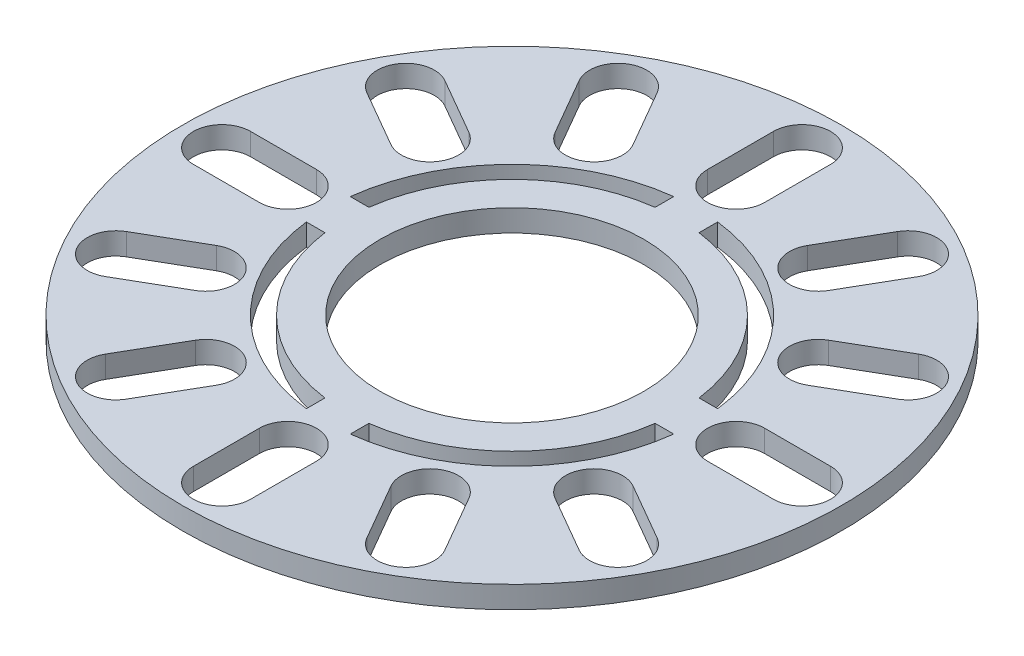
from build123d import *

# Parameters (mm, degrees)
SKETCH1_R           = 75
SKETCH1_R_2         = 30
BOSS_EXTRUDE1_DEPTH = 5
CUT_EXTRUDE1_DEPTH  = 107.183802908


with BuildPart() as part:
    # Sketch1 → Boss-Extrude1 (new body)
    with BuildSketch(Plane(origin=(0, 0, 0), x_dir=(1, 0, 0), z_dir=(0, 1, 0))):
        with Locations(Location((0, 0, 0), (0, 0, 270))):
            Circle(SKETCH1_R)
        with Locations(Location((0, 0, 0), (0, 0, 270))):
            Circle(SKETCH1_R_2, mode=Mode.SUBTRACT)
        with BuildLine():
            Line((-5, 41.802033443), (-5, 37.568737003))
            ThreePointArc((-5, 37.568737003), (-26.799347007, 26.799347007), (-37.568737003, 5))
            Line((-37.568737003, 5), (-41.802033443, 5))
            ThreePointArc((-41.802033443, 5), (-29.769195488, 29.769195488), (-5, 41.802033443))
        make_face(mode=Mode.SUBTRACT)
        with BuildLine():
            Line((5, 41.802033443), (5, 37.568737003))
            ThreePointArc((5, 37.568737003), (26.799347007, 26.799347007), (37.568737003, 5))
            Line((37.568737003, 5), (41.802033443, 5))
            ThreePointArc((41.802033443, 5), (29.769195488, 29.769195488), (5, 41.802033443))
        make_face(mode=Mode.SUBTRACT)
        with BuildLine():
            Line((41.802033443, -5), (37.568737003, -5))
            ThreePointArc((37.568737003, -5), (26.799347007, -26.799347007), (5, -37.568737003))
            Line((5, -37.568737003), (5, -41.802033443))
            ThreePointArc((5, -41.802033443), (29.769195488, -29.769195488), (41.802033443, -5))
        make_face(mode=Mode.SUBTRACT)
        with BuildLine():
            Line((-5, -41.802033443), (-5, -37.568737003))
            ThreePointArc((-5, -37.568737003), (-26.799347007, -26.799347007), (-37.568737003, -5))
            Line((-37.568737003, -5), (-41.802033443, -5))
            ThreePointArc((-41.802033443, -5), (-29.769195488, -29.769195488), (-5, -41.802033443))
        make_face(mode=Mode.SUBTRACT)
    extrude(amount=BOSS_EXTRUDE1_DEPTH)

    # Sketch4 → Cut-Extrude1 (cut, through all)
    with BuildSketch(Plane(origin=(0, 5, 0), x_dir=(1, 0, 0), z_dir=(0, 1, 0))):
        with BuildLine():
            Line((-6.5, 51), (-6.5, 66))
            ThreePointArc((-6.5, 66), (0, 72.5), (6.5, 66))
            Line((6.5, 66), (6.5, 51))
            ThreePointArc((6.5, 51), (0, 44.5), (-6.5, 51))
        make_face()
        with BuildLine():
            Line((31.129165125, 40.917295593), (38.629165125, 53.90767665))
            ThreePointArc((38.629165125, 53.90767665), (36.25, 62.786841774), (27.370834875, 60.40767665))
            Line((27.370834875, 60.40767665), (19.870834875, 47.417295593))
            ThreePointArc((19.870834875, 47.417295593), (22.25, 38.538130468), (31.129165125, 40.917295593))
        make_face()
        with BuildLine():
            Line((47.417295593, 19.870834875), (60.40767665, 27.370834875))
            ThreePointArc((60.40767665, 27.370834875), (62.786841774, 36.25), (53.90767665, 38.629165125))
            Line((53.90767665, 38.629165125), (40.917295593, 31.129165125))
            ThreePointArc((40.917295593, 31.129165125), (38.538130468, 22.25), (47.417295593, 19.870834875))
        make_face()
        with BuildLine():
            Line((51, -6.5), (66, -6.5))
            ThreePointArc((66, -6.5), (72.5, 0), (66, 6.5))
            Line((66, 6.5), (51, 6.5))
            ThreePointArc((51, 6.5), (44.5, 0), (51, -6.5))
        make_face()
        with BuildLine():
            Line((40.917295593, -31.129165125), (53.90767665, -38.629165125))
            ThreePointArc((53.90767665, -38.629165125), (62.786841774, -36.25), (60.40767665, -27.370834875))
            Line((60.40767665, -27.370834875), (47.417295593, -19.870834875))
            ThreePointArc((47.417295593, -19.870834875), (38.538130468, -22.25), (40.917295593, -31.129165125))
        make_face()
        with BuildLine():
            Line((19.870834875, -47.417295593), (27.370834875, -60.40767665))
            ThreePointArc((27.370834875, -60.40767665), (36.25, -62.786841774), (38.629165125, -53.90767665))
            Line((38.629165125, -53.90767665), (31.129165125, -40.917295593))
            ThreePointArc((31.129165125, -40.917295593), (22.25, -38.538130468), (19.870834875, -47.417295593))
        make_face()
        with BuildLine():
            Line((-6.5, -51), (-6.5, -66))
            ThreePointArc((-6.5, -66), (0, -72.5), (6.5, -66))
            Line((6.5, -66), (6.5, -51))
            ThreePointArc((6.5, -51), (0, -44.5), (-6.5, -51))
        make_face()
        with BuildLine():
            Line((-31.129165125, -40.917295593), (-38.629165125, -53.90767665))
            ThreePointArc((-38.629165125, -53.90767665), (-36.25, -62.786841774), (-27.370834875, -60.40767665))
            Line((-27.370834875, -60.40767665), (-19.870834875, -47.417295593))
            ThreePointArc((-19.870834875, -47.417295593), (-22.25, -38.538130468), (-31.129165125, -40.917295593))
        make_face()
        with BuildLine():
            Line((-47.417295593, -19.870834875), (-60.40767665, -27.370834875))
            ThreePointArc((-60.40767665, -27.370834875), (-62.786841774, -36.25), (-53.90767665, -38.629165125))
            Line((-53.90767665, -38.629165125), (-40.917295593, -31.129165125))
            ThreePointArc((-40.917295593, -31.129165125), (-38.538130468, -22.25), (-47.417295593, -19.870834875))
        make_face()
        with BuildLine():
            Line((-51, 6.5), (-66, 6.5))
            ThreePointArc((-66, 6.5), (-72.5, 0), (-66, -6.5))
            Line((-66, -6.5), (-51, -6.5))
            ThreePointArc((-51, -6.5), (-44.5, 0), (-51, 6.5))
        make_face()
        with BuildLine():
            Line((-40.917295593, 31.129165125), (-53.90767665, 38.629165125))
            ThreePointArc((-53.90767665, 38.629165125), (-62.786841774, 36.25), (-60.40767665, 27.370834875))
            Line((-60.40767665, 27.370834875), (-47.417295593, 19.870834875))
            ThreePointArc((-47.417295593, 19.870834875), (-38.538130468, 22.25), (-40.917295593, 31.129165125))
        make_face()
        with BuildLine():
            Line((-19.870834875, 47.417295593), (-27.370834875, 60.40767665))
            ThreePointArc((-27.370834875, 60.40767665), (-36.25, 62.786841774), (-38.629165125, 53.90767665))
            Line((-38.629165125, 53.90767665), (-31.129165125, 40.917295593))
            ThreePointArc((-31.129165125, 40.917295593), (-22.25, 38.538130468), (-19.870834875, 47.417295593))
        make_face()
    extrude(amount=-CUT_EXTRUDE1_DEPTH, mode=Mode.SUBTRACT)


solid = part.part
